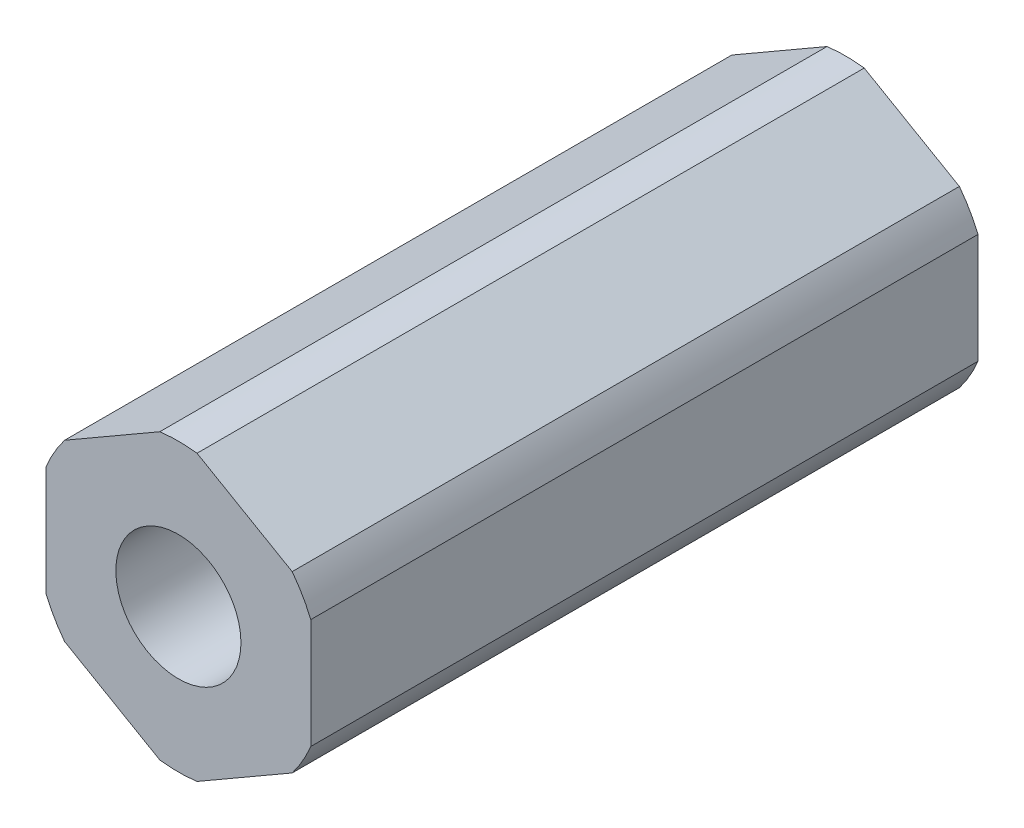
from build123d import *

# Parameters (mm, degrees)
SKETCH1_R           = 3
BOSS_EXTRUDE1_DEPTH = 16


with BuildPart() as part:
    # Sketch1 → Boss-Extrude1 (new, symmetric)
    with BuildSketch(Plane.XY):
        with BuildLine():
            Line((-0.893039494, 6.816751826), (-5.456960506, 4.181770802))
            ThreePointArc((-5.456960506, 4.181770802), (-5.953924651, 3.4375), (-6.35, 2.634981025))
            Line((-6.35, 2.634981025), (-6.35, -2.634981025))
            ThreePointArc((-6.35, -2.634981025), (-5.953924651, -3.4375), (-5.456960506, -4.181770802))
            Line((-5.456960506, -4.181770802), (-0.893039494, -6.816751826))
            ThreePointArc((-0.893039494, -6.816751826), (0, -6.875), (0.893039494, -6.816751826))
            Line((0.893039494, -6.816751826), (5.456960506, -4.181770802))
            ThreePointArc((5.456960506, -4.181770802), (5.953924651, -3.4375), (6.35, -2.634981025))
            Line((6.35, -2.634981025), (6.35, 2.634981025))
            ThreePointArc((6.35, 2.634981025), (5.953924651, 3.4375), (5.456960506, 4.181770802))
            Line((5.456960506, 4.181770802), (0.893039494, 6.816751826))
            ThreePointArc((0.893039494, 6.816751826), (0, 6.875), (-0.893039494, 6.816751826))
        make_face()
        Circle(SKETCH1_R, mode=Mode.SUBTRACT)
    extrude(amount=BOSS_EXTRUDE1_DEPTH, both=True)


solid = part.part
